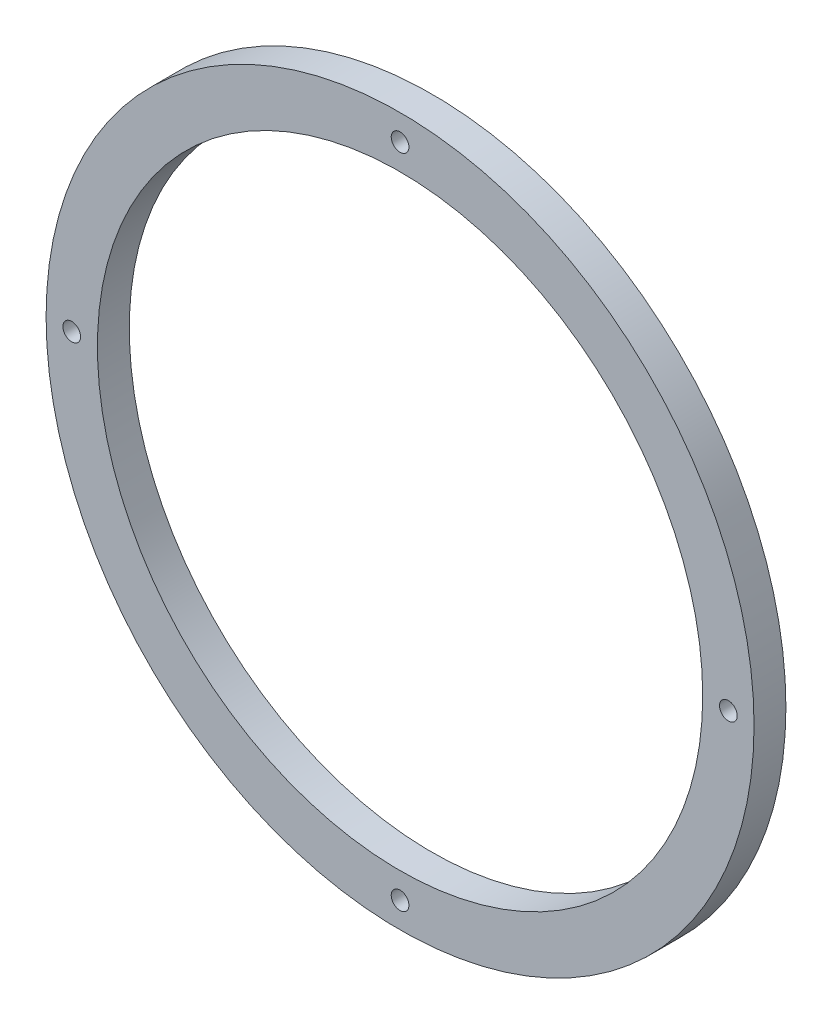
from build123d import *

# Parameters (mm, degrees)
SKETCH_1_R          = 100
SKETCH_1_R_2        = 85.5
EXTRUDE_1_DEPTH     = 9
SKETCH_2_R          = 2.5
CUT_EXTRUDE_1_DEPTH = 142.707445111


with BuildPart() as part:
    # 草图1 → 凸台-拉伸1 (new body)
    with BuildSketch(Plane.XY):
        Circle(SKETCH_1_R)
        Circle(SKETCH_1_R_2, mode=Mode.SUBTRACT)
    extrude(amount=EXTRUDE_1_DEPTH)

    # 草图2 → 切除-拉伸1 (cut, through all)
    with BuildSketch(Plane.XY.offset(9)):
        with Locations((0, 92.75)):
            Circle(SKETCH_2_R)
        with Locations((92.75, 0)):
            Circle(SKETCH_2_R)
        with Locations((0, -92.75)):
            Circle(SKETCH_2_R)
        with Locations((-92.75, 0)):
            Circle(SKETCH_2_R)
    extrude(amount=-CUT_EXTRUDE_1_DEPTH, mode=Mode.SUBTRACT)


solid = part.part
